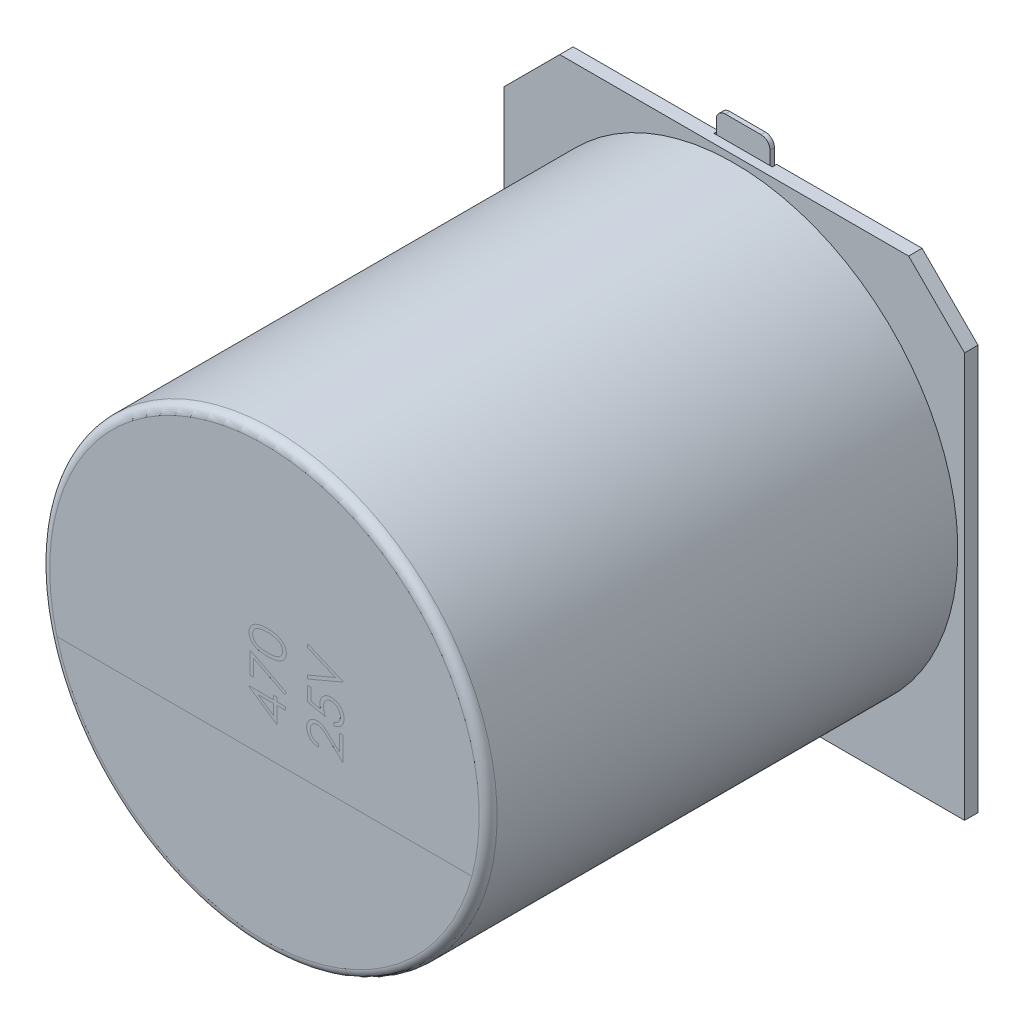
from build123d import *

# Parameters (mm, degrees)
RESSALTO_EXTRUS_O1_DEPTH   = 0.3
ESBO_O2_R                  = 5
RESSALTO_EXTRUS_O2_DEPTH   = 10.5
FILETE1_R                  = 0.2
CORTE_EXTRUS_O1_DEPTH      = 0.0001
CORTE_EXTRUS_O2_DEPTH      = 0.0001
ESBO_O5_W                  = 1.3
ESBO_O5_H                  = 3.2
CORTE_EXTRUS_O3_DEPTH      = 0.1
RESSALTO_EXTRUS_O3_DEPTH   = 0.1
RESSALTO_EXTRUS_O3_2_DEPTH = 0.1


with BuildPart() as part:
    # Esboço1 → Ressalto-extrusão1 (new body)
    with BuildSketch(Plane.XY):
        Polygon((-5.15, 3.9), (-3.9, 5.15), (3.9, 5.15), (5.15, 3.9), (5.15, -5.15), (-5.15, -5.15), align=None)
    extrude(amount=RESSALTO_EXTRUS_O1_DEPTH)

    # Esboço5 → Corte-extrusão3 (cut)
    with BuildSketch(Plane(origin=(0, 0, 0), x_dir=(-1, 0, 0), z_dir=(0, 0, -1))):
        with Locations((0, 4.05)):
            Rectangle(ESBO_O5_W, ESBO_O5_H)
        with Locations((0, -4.05)):
            Rectangle(ESBO_O5_W, ESBO_O5_H)
    extrude(amount=-CORTE_EXTRUS_O3_DEPTH, mode=Mode.SUBTRACT)


with BuildPart() as body_2:
    # Esboço2 → Ressalto-extrusão2 (new body)
    with BuildSketch(Plane.XY.offset(0.3)):
        with Locations(Location((0, 0, 0), (0, 0, 180))):
            Circle(ESBO_O2_R)
    extrude(amount=RESSALTO_EXTRUS_O2_DEPTH)

    # Filete1
    filete1_edges = [body_2.edges().sort_by_distance(p)[0] for p in [
        (5, 0, 10.8),
    ]]
    fillet(filete1_edges, radius=FILETE1_R)

    # Esboço3 → Corte-extrusão1 (cut)
    with BuildSketch(Plane.XY.offset(10.8)):
        with BuildLine():
            Line((-4.638191195, -1.235792231), (4.638191195, -1.235792231))
            ThreePointArc((4.638191195, -1.235792231), (0, -4.8), (-4.638191195, -1.235792231))
        make_face()
    extrude(amount=-CORTE_EXTRUS_O1_DEPTH, mode=Mode.SUBTRACT)

    # Esboço4 → Corte-extrusão2 (cut)
    # profile 1 of 6: a face of its own
    with BuildSketch(Plane.XY.offset(10.8)):
        Polygon((-0.345603573, -0.053115773), (-0.345603573, -0.038646372), (0.203915658, -0.038646372), (0.203915658, 0.052940167), (0.285325914, 0.052940167), (0.285325914, -0.038646372), (0.468498991, -0.038646372), (0.468498991, -0.109880346), (0.285325914, -0.109880346), (0.285325914, -0.486402782), align=None)
        Polygon((0.203915658, -0.109880346), (-0.140805897, -0.109880346), (0.203915658, -0.346478904), align=None, mode=Mode.SUBTRACT)
    # profile 2 of 6: a face of its own
    with BuildSketch(Plane.XY.offset(10.8)):
        Polygon((-0.325251009, 0.175055551), (-0.325251009, 0.66351709), (0.488851555, 0.246289526), (0.454983617, 0.18475482), (-0.243840752, 0.542991749), (-0.243840752, 0.175055551), align=None)
    # profile 3 of 6: a face of its own
    with BuildSketch(Plane.XY.offset(10.8)):
        with BuildLine():
            add(Edge.make_bspline(
                [(0.071942, 0.734751064), (0.059219914, 0.734825454), (0.034507078, 0.734969957), (-0.00150301, 0.73657751), (-0.035285076, 0.739247989), (-0.066840735, 0.742907715), (-0.096178136, 0.747361328), (-0.123218874, 0.753306628), (-0.148088112, 0.76006774), (-0.170866913, 0.76790376), (-0.191862285, 0.776745567), (-0.211462033, 0.786369287), (-0.229637975, 0.797155467), (-0.246674948, 0.808492502), (-0.262312749, 0.82082174), (-0.276731555, 0.833878818), (-0.28980977, 0.847924881), (-0.30155635, 0.862823694), (-0.311856387, 0.878474281), (-0.320984885, 0.894448969), (-0.328503981, 0.911033192), (-0.334654808, 0.928008628), (-0.339675871, 0.945411053), (-0.343124826, 0.963236025), (-0.345291044, 0.981524865), (-0.345498408, 0.993869064), (-0.345603573, 1.00012942)],
                knots=[0, 0, 0, 0, 1.646148282, 3.197666765, 4.66315463, 6.030252048, 7.307778049, 8.501004361, 9.610818041, 10.641065266, 11.615491391, 12.557119604, 13.464013759, 14.348536654, 15.203310953, 16.038349431, 16.863300206, 17.683791446, 18.490318933, 19.285717724, 20.06220424, 20.843281102, 21.620494212, 22.403315558, 23.190242141, 24, 24, 24, 24], degree=3))
            add(Edge.make_bspline(
                [(-0.345603573, 1.00012942), (-0.345515977, 1.00644517), (-0.345341692, 1.01901129), (-0.342888524, 1.037522708), (-0.339722149, 1.055711688), (-0.334643805, 1.073302268), (-0.328566908, 1.090627052), (-0.320548538, 1.107255208), (-0.311827939, 1.123773797), (-0.301189542, 1.139432401), (-0.289432362, 1.154698872), (-0.276084957, 1.169009594), (-0.261516717, 1.182730389), (-0.24540273, 1.195343026), (-0.227990069, 1.207388067), (-0.209132766, 1.218408268), (-0.188872613, 1.228632831), (-0.167303531, 1.238253949), (-0.143849378, 1.246667363), (-0.118656443, 1.254147561), (-0.091496591, 1.260278849), (-0.062521121, 1.265349316), (-0.031586489, 1.269284964), (0.001244629, 1.272149262), (0.035992772, 1.273662794), (0.059750363, 1.273947772), (0.071942, 1.274094013)],
                knots=[0, 0, 0, 0, 0.810910589, 1.61342667, 2.396193133, 3.181089899, 3.963115317, 4.752255436, 5.550715454, 6.36105385, 7.181178335, 8.024612154, 8.872680183, 9.750181803, 10.651284446, 11.591556747, 12.554036451, 13.566402641, 14.62422919, 15.753422176, 16.94128843, 18.199818041, 19.531985927, 20.947085226, 22.433341622, 24, 24, 24, 24], degree=3))
            add(Edge.make_bspline(
                [(0.071942, 1.274094013), (0.084080351, 1.273944554), (0.107784376, 1.273652688), (0.142377799, 1.272181723), (0.17503195, 1.269215002), (0.205781643, 1.265558146), (0.234641136, 1.260431007), (0.261591622, 1.254253228), (0.28672852, 1.247214567), (0.309871727, 1.23867203), (0.331403379, 1.229274851), (0.351514561, 1.21906126), (0.370366884, 1.208103247), (0.387825473, 1.196238854), (0.403874782, 1.183418752), (0.418492988, 1.169707575), (0.431925288, 1.155271903), (0.443811997, 1.139916431), (0.45453139, 1.124111976), (0.463568455, 1.107591709), (0.471398542, 1.090778428), (0.47780036, 1.073504269), (0.482765044, 1.055795901), (0.486177994, 1.037594454), (0.488577036, 1.019008678), (0.488759732, 1.006444296), (0.488851555, 1.00012942)],
                knots=[0, 0, 0, 0, 1.561645053, 3.049612875, 4.452756685, 5.778837748, 7.032101753, 8.221335837, 9.334924186, 10.387562255, 11.392109817, 12.355697819, 13.287721948, 14.19548756, 15.068665045, 15.927346723, 16.771751757, 17.602390507, 18.423119567, 19.225778204, 20.022010933, 20.807278863, 21.593079439, 22.384715467, 23.188155646, 24, 24, 24, 24], degree=3))
            add(Edge.make_bspline(
                [(0.488851555, 1.00012942), (0.488745793, 0.993869201), (0.488537249, 0.981525272), (0.486379671, 0.963234454), (0.482910869, 0.945481114), (0.47805389, 0.928177646), (0.472108737, 0.911235278), (0.464363177, 0.89488486), (0.455442746, 0.878944656), (0.445283883, 0.86345696), (0.433644479, 0.848713692), (0.420772596, 0.834628474), (0.406338155, 0.821568176), (0.390568411, 0.809345844), (0.373506091, 0.797888956), (0.355139743, 0.787195982), (0.335438006, 0.777370446), (0.314276706, 0.768377578), (0.291336231, 0.760404398), (0.266403599, 0.753388777), (0.239225568, 0.747785617), (0.209940125, 0.743036072), (0.178487766, 0.7392302), (0.144857112, 0.736578619), (0.109112023, 0.734971178), (0.084558104, 0.734825774), (0.071942, 0.734751064)],
                knots=[0, 0, 0, 0, 0.810927267, 1.598990287, 2.382942141, 3.152806972, 3.926217614, 4.706701772, 5.493896336, 6.292070767, 7.104102563, 7.925577746, 8.761822141, 9.623241997, 10.509042271, 11.423174113, 12.375371989, 13.360203808, 14.400680605, 15.520553799, 16.714061498, 17.994519714, 19.364400916, 20.818312473, 22.365209998, 24, 24, 24, 24], degree=3))
        make_face()
        with BuildLine():
            add(Edge.make_bspline(
                [(0.071623991, 0.805985039), (0.082225886, 0.806012722), (0.102802082, 0.806066449), (0.13264999, 0.80742941), (0.160535909, 0.809326513), (0.186448955, 0.811713177), (0.210298564, 0.815287547), (0.232183885, 0.819342888), (0.252064411, 0.824207022), (0.270113872, 0.829990544), (0.286587858, 0.836578538), (0.301925458, 0.843758841), (0.316308451, 0.85154088), (0.329701941, 0.860084171), (0.341942209, 0.86955762), (0.353339517, 0.879522037), (0.363497477, 0.890426314), (0.375682392, 0.905507742), (0.388273135, 0.925419045), (0.399237399, 0.950506088), (0.40612769, 0.976284493), (0.407003937, 0.993781291), (0.407441299, 1.002514486)],
                knots=[0, 0, 0, 0, 1.459098681, 2.831824031, 4.11146945, 5.306290378, 6.412266529, 7.42953815, 8.369053297, 9.227277979, 10.03601793, 10.809473603, 11.557037441, 12.285528272, 12.993193355, 13.685654407, 14.36688038, 15.041354379, 16.352855396, 17.594313975, 18.799247529, 20, 20, 20, 20], degree=3))
            add(Edge.make_bspline(
                [(0.407441299, 1.002514486), (0.407058336, 1.011298233), (0.40629377, 1.02883457), (0.399620933, 1.054589295), (0.388773019, 1.079385248), (0.376379534, 1.098953952), (0.364501248, 1.113800161), (0.354385544, 1.124441149), (0.343055639, 1.134206761), (0.330832223, 1.143469228), (0.317480736, 1.151964392), (0.303065666, 1.159689431), (0.287546902, 1.166738689), (0.276713408, 1.170754847), (0.271174522, 1.172808206)],
                knots=[0, 0, 0, 0, 1.353621445, 2.702441307, 4.075953605, 5.516772412, 6.261413105, 7.007624062, 7.778524365, 8.566925914, 9.372323995, 10.217594641, 11.088702136, 12, 12, 12, 12], degree=3))
            add(Edge.make_bspline(
                [(0.271174522, 1.172808206), (0.264092063, 1.175201196), (0.249711635, 1.180059992), (0.227404164, 1.186321948), (0.203999251, 1.191253494), (0.179636769, 1.195690186), (0.154137051, 1.198718468), (0.127578996, 1.201155919), (0.09994258, 1.202591628), (0.081165859, 1.202769599), (0.071623991, 1.202860039)],
                knots=[0, 0, 0, 0, 0.884706709, 1.796334032, 2.740027952, 3.714592787, 4.726048262, 5.777819803, 6.87074269, 8, 8, 8, 8], degree=3))
            add(Edge.make_bspline(
                [(0.071623991, 1.202860039), (0.062083667, 1.202735264), (0.043420753, 1.202491177), (0.016088951, 1.201558183), (-0.009870702, 1.199148908), (-0.034570041, 1.196473037), (-0.057872343, 1.192527596), (-0.079972678, 1.188273592), (-0.100597263, 1.182558323), (-0.120068967, 1.176453281), (-0.138166693, 1.169465998), (-0.154974374, 1.161774135), (-0.170574701, 1.153560465), (-0.184919474, 1.144635034), (-0.198091899, 1.135122162), (-0.209788879, 1.124680773), (-0.220579408, 1.113973972), (-0.232676388, 1.098746643), (-0.245108031, 1.078973493), (-0.256237175, 1.054199295), (-0.262823702, 1.028559068), (-0.263737107, 1.011189754), (-0.264193316, 1.002514486)],
                knots=[0, 0, 0, 0, 1.313483664, 2.569454835, 3.763100662, 4.901599063, 5.988328865, 7.015709358, 7.99797933, 8.932480776, 9.824041341, 10.666387587, 11.475829342, 12.24921787, 12.990555181, 13.709176526, 14.405678811, 15.080244297, 16.38186033, 17.610124501, 18.806354173, 20, 20, 20, 20], degree=3))
            add(Edge.make_bspline(
                [(-0.264193316, 1.002514486), (-0.263735972, 0.993734143), (-0.262820451, 0.976157462), (-0.256267635, 0.950243421), (-0.245140593, 0.925301858), (-0.232700339, 0.905463504), (-0.220625789, 0.890421162), (-0.210348957, 0.879746763), (-0.199223869, 0.869644153), (-0.186875016, 0.860416018), (-0.173528717, 0.851923386), (-0.159331722, 0.843840599), (-0.143965464, 0.836756316), (-0.127504396, 0.830147171), (-0.109453941, 0.824354003), (-0.089501481, 0.819545447), (-0.067563896, 0.815167825), (-0.043540029, 0.812015224), (-0.017621452, 0.80923915), (0.010335781, 0.807450237), (0.040286184, 0.806060205), (0.060968838, 0.806010596), (0.071623991, 0.805985039)],
                knots=[0, 0, 0, 0, 1.207546505, 2.417292871, 3.651582144, 4.952510111, 5.626719005, 6.30238548, 6.989136872, 7.692112372, 8.420316868, 9.164734959, 9.937886623, 10.746308695, 11.604196049, 12.543341915, 13.568754172, 14.680483261, 15.875568977, 17.154711427, 18.534182925, 20, 20, 20, 20], degree=3))
        make_face(mode=Mode.SUBTRACT)
    # profile 4 of 6: a face of its own
    with BuildSketch(Plane.XY.offset(10.8)):
        with BuildLine():
            Line((1.208686588, -0.384639961), (1.208686588, -0.455873936))
            add(Edge.make_bspline(
                [(1.208686588, -0.455873936), (1.199236226, -0.455409671), (1.180675967, -0.454497866), (1.153615009, -0.450227879), (1.12774901, -0.444118073), (1.103285655, -0.435479476), (1.080008639, -0.424751088), (1.058010422, -0.411885528), (1.03737492, -0.396646923), (1.018293432, -0.379364324), (1.000788394, -0.360593579), (0.985671937, -0.340340268), (0.972899894, -0.319057556), (0.962222541, -0.296810014), (0.954207968, -0.273346636), (0.948261275, -0.248880345), (0.944683425, -0.223303648), (0.944298845, -0.205877429), (0.944103255, -0.197014761)],
                knots=[0, 0, 0, 0, 1.10065271, 2.161652631, 3.183658789, 4.190468796, 5.17591951, 6.163126047, 7.15150782, 8.156236427, 9.156009102, 10.134482811, 11.092018607, 12.041330605, 13.001268258, 13.972401359, 14.968799086, 16, 16, 16, 16], degree=3))
            add(Edge.make_bspline(
                [(0.944103255, -0.197014761), (0.944305358, -0.18831055), (0.944702485, -0.171207085), (0.948164181, -0.146255257), (0.953468922, -0.122445229), (0.961329712, -0.10004684), (0.971193285, -0.078830219), (0.983459929, -0.059058064), (0.99754923, -0.040252262), (1.01416825, -0.02333577), (1.031900787, -0.007795932), (1.050838988, 0.005598469), (1.07042167, 0.017133833), (1.090801804, 0.026575168), (1.112045757, 0.03373212), (1.133949855, 0.039034735), (1.156766887, 0.042065996), (1.172212925, 0.042528662), (1.180065795, 0.042763885)],
                knots=[0, 0, 0, 0, 1.111674182, 2.184400057, 3.212814286, 4.223731311, 5.211378316, 6.196328225, 7.191884489, 8.207283132, 9.220262353, 10.201199469, 11.166417575, 12.120932471, 13.06540007, 14.026332106, 14.996573967, 16, 16, 16, 16], degree=3))
            add(Edge.make_bspline(
                [(1.180065795, 0.042763885), (1.191121103, 0.042379871), (1.213037713, 0.041618582), (1.245244725, 0.03510666), (1.276448681, 0.024935775), (1.301563175, 0.012691032), (1.321798141, 0.00033503), (1.338466838, -0.010788384), (1.35640982, -0.023884236), (1.375699712, -0.038840642), (1.396083895, -0.055915171), (1.417978262, -0.074664229), (1.440977972, -0.095572017), (1.456697317, -0.110233403), (1.464842688, -0.117830566)],
                knots=[0, 0, 0, 0, 1.184416499, 2.348048165, 3.509039915, 4.696071444, 5.333504901, 6.05069495, 6.844171097, 7.714965912, 8.667477798, 9.695072654, 10.805644396, 12, 12, 12, 12], degree=3))
            Line((1.464842688, -0.117830566), (1.676795562, -0.316427071))
            Line((1.676795562, -0.316427071), (1.676795562, 0.052940167))
            Line((1.676795562, 0.052940167), (1.758205819, 0.052940167))
            Line((1.758205819, 0.052940167), (1.758205819, -0.486402782))
            Line((1.758205819, -0.486402782), (1.429702714, -0.17857025))
            add(Edge.make_bspline(
                [(1.429702714, -0.17857025), (1.421878991, -0.171075461), (1.40685122, -0.156679506), (1.384911299, -0.1363181), (1.364557385, -0.11803033), (1.345827936, -0.101697814), (1.328448991, -0.087674858), (1.312983406, -0.07523062), (1.298751593, -0.065259852), (1.282255061, -0.054438682), (1.262113696, -0.043958011), (1.237499806, -0.034951816), (1.212161661, -0.029460234), (1.195038878, -0.028801459), (1.186425971, -0.02847009)],
                knots=[0, 0, 0, 0, 1.329631726, 2.553950428, 3.673215718, 4.687767853, 5.603093632, 6.413772471, 7.123043292, 7.734684054, 8.834405432, 9.900288307, 10.943827018, 12, 12, 12, 12], degree=3))
            add(Edge.make_bspline(
                [(1.186425971, -0.02847009), (1.181010011, -0.028614267), (1.170336194, -0.028898413), (1.154686674, -0.03140614), (1.139590725, -0.035195844), (1.125001913, -0.040626287), (1.111066917, -0.047794244), (1.097768774, -0.056519457), (1.084912527, -0.066586489), (1.072858118, -0.078232223), (1.061817916, -0.09102555), (1.052037989, -0.104540675), (1.043864834, -0.118839538), (1.037164791, -0.133861851), (1.031908945, -0.149565734), (1.028267089, -0.16598156), (1.025980526, -0.183063971), (1.025671151, -0.194728353), (1.025513511, -0.200671862)],
                knots=[0, 0, 0, 0, 0.991446411, 1.95395049, 2.89581595, 3.838931463, 4.798493298, 5.75982156, 6.748411868, 7.785213223, 8.824556874, 9.840280684, 10.836137867, 11.835679398, 12.848801643, 13.863922112, 14.911575587, 16, 16, 16, 16], degree=3))
            add(Edge.make_bspline(
                [(1.025513511, -0.200671862), (1.025669272, -0.206880734), (1.02597516, -0.219073933), (1.028292108, -0.23693825), (1.031804603, -0.254097705), (1.037383212, -0.270296265), (1.043974615, -0.285884699), (1.052348282, -0.300530217), (1.06207867, -0.314475982), (1.073361451, -0.327492612), (1.086038472, -0.339380937), (1.100009424, -0.349973264), (1.115173727, -0.359167402), (1.131469144, -0.367200405), (1.149057917, -0.373721028), (1.167873614, -0.378704439), (1.18783566, -0.382647468), (1.201620841, -0.383964766), (1.208686588, -0.384639961)],
                knots=[0, 0, 0, 0, 1.030878251, 2.024474673, 2.987898669, 3.934362936, 4.864849709, 5.795128259, 6.730474222, 7.685293701, 8.650606017, 9.611896181, 10.591709709, 11.591680886, 12.625074257, 13.701333388, 14.821793024, 16, 16, 16, 16], degree=3))
        make_face()
    # profile 5 of 6: a face of its own
    with BuildSketch(Plane.XY.offset(10.8)):
        with BuildLine():
            Line((0.964455819, 0.622811962), (1.045866075, 0.622811962))
            Line((1.045866075, 0.622811962), (1.045866075, 0.352822479))
            Line((1.045866075, 0.352822479), (1.254638862, 0.310050293))
            add(Edge.make_bspline(
                [(1.254638862, 0.310050293), (1.252318782, 0.318454036), (1.247823995, 0.334734959), (1.242833401, 0.358765142), (1.239824988, 0.381578016), (1.239414208, 0.396381538), (1.239215434, 0.403544884)],
                knots=[0, 0, 0, 0, 1.100273476, 2.13160584, 3.095893838, 4, 4, 4, 4], degree=3))
            add(Edge.make_bspline(
                [(1.239215434, 0.403544884), (1.239400945, 0.412410145), (1.239765704, 0.429841463), (1.243476183, 0.455305939), (1.248850508, 0.47973696), (1.257130674, 0.502773804), (1.267242233, 0.524780936), (1.279977962, 0.545380411), (1.294846895, 0.564861343), (1.311772453, 0.583089091), (1.33059354, 0.59954761), (1.350913659, 0.613849521), (1.372289391, 0.626332436), (1.395221738, 0.636067989), (1.419278191, 0.644013151), (1.44473644, 0.64925221), (1.471370474, 0.652751674), (1.489582615, 0.653141846), (1.498869631, 0.653340808)],
                knots=[0, 0, 0, 0, 1.052805225, 2.070078116, 3.052532748, 4.020689046, 4.973125432, 5.925915817, 6.89216474, 7.881560752, 8.877013184, 9.857446635, 10.830895175, 11.812622661, 12.812548702, 13.836681939, 14.896847428, 16, 16, 16, 16], degree=3))
            add(Edge.make_bspline(
                [(1.498869631, 0.653340808), (1.505338023, 0.653189842), (1.518187391, 0.652889952), (1.537270687, 0.651368264), (1.555947196, 0.648427218), (1.57418268, 0.644526477), (1.591994217, 0.639319181), (1.609481532, 0.633228301), (1.626453142, 0.625657741), (1.642984003, 0.617264929), (1.658884924, 0.607971472), (1.673774653, 0.597521185), (1.687992976, 0.586662736), (1.701117631, 0.574797875), (1.713199525, 0.5620615), (1.72429839, 0.548524478), (1.734613416, 0.53430959), (1.74372285, 0.519192954), (1.752105558, 0.503512475), (1.758982493, 0.48704142), (1.765130776, 0.470154801), (1.770031508, 0.452609551), (1.773871569, 0.434445419), (1.776479741, 0.415632461), (1.778379398, 0.396269345), (1.778498314, 0.383144119), (1.778558383, 0.376514135)],
                knots=[0, 0, 0, 0, 1.056393913, 2.098511576, 3.122979385, 4.141471433, 5.141222888, 6.151259816, 7.162667642, 8.172852865, 9.177685681, 10.166741883, 11.141342384, 12.097242845, 13.052202613, 14.005160326, 14.953864445, 15.917140761, 16.884916217, 17.854238259, 18.828761908, 19.81781811, 20.826036654, 21.857789401, 22.917898972, 24, 24, 24, 24], degree=3))
            add(Edge.make_bspline(
                [(1.778558383, 0.376514135), (1.778401289, 0.368605371), (1.778092226, 0.353045811), (1.774873683, 0.330246308), (1.770233505, 0.308323315), (1.763358828, 0.287370792), (1.754356929, 0.267476122), (1.743661311, 0.248354419), (1.730928342, 0.230242686), (1.716274485, 0.21326475), (1.700172983, 0.197658263), (1.682867024, 0.183506186), (1.664334566, 0.171063896), (1.644635871, 0.160286262), (1.623805881, 0.151104699), (1.601780413, 0.143888739), (1.578670772, 0.138065468), (1.562760982, 0.13560177), (1.554680178, 0.134350423)],
                knots=[0, 0, 0, 0, 1.046872515, 2.059598001, 3.044168548, 4.012104806, 4.973680974, 5.932408326, 6.910122221, 7.900780896, 8.89867654, 9.876692837, 10.858029398, 11.85084981, 12.847361615, 13.868568023, 14.917415949, 16, 16, 16, 16], degree=3))
            Line((1.554680178, 0.134350423), (1.554680178, 0.205584398))
            add(Edge.make_bspline(
                [(1.554680178, 0.205584398), (1.562250269, 0.207336028), (1.576800403, 0.210702757), (1.597230416, 0.218111867), (1.615442484, 0.227082822), (1.631547957, 0.237998912), (1.645841643, 0.250652057), (1.658444355, 0.265360684), (1.669828044, 0.281757082), (1.679333202, 0.299986657), (1.687340015, 0.3192562), (1.693053939, 0.339309296), (1.696512701, 0.359857341), (1.696935521, 0.373691864), (1.697148127, 0.38064825)],
                knots=[0, 0, 0, 0, 1.13623081, 2.183898708, 3.172478118, 4.09966615, 5.022692284, 5.957376522, 6.927682873, 7.937366477, 8.960015386, 9.976409503, 10.982481913, 12, 12, 12, 12], degree=3))
            add(Edge.make_bspline(
                [(1.697148127, 0.38064825), (1.696960428, 0.387441821), (1.696590849, 0.400818417), (1.693792198, 0.420514266), (1.689368736, 0.43947429), (1.68317172, 0.457732145), (1.67497343, 0.475198115), (1.664902304, 0.491847506), (1.653209606, 0.507917502), (1.63984528, 0.522985166), (1.62510942, 0.536781957), (1.609353374, 0.548973267), (1.592544618, 0.559127982), (1.574974844, 0.567685552), (1.556451306, 0.574183707), (1.537060863, 0.57881943), (1.516755608, 0.581541552), (1.502905961, 0.581916017), (1.495848547, 0.582106834)],
                knots=[0, 0, 0, 0, 1.027268864, 2.022700798, 3.002744649, 3.968653148, 4.933396556, 5.915045722, 6.907600446, 7.935526002, 8.956456544, 9.95700807, 10.942805781, 11.92166854, 12.907987664, 13.905483474, 14.932689774, 16, 16, 16, 16], degree=3))
            add(Edge.make_bspline(
                [(1.495848547, 0.582106834), (1.489480615, 0.581962037), (1.477068857, 0.581679814), (1.458846477, 0.579236628), (1.441577021, 0.575155324), (1.425185347, 0.569344376), (1.409723862, 0.562092128), (1.39522664, 0.55298671), (1.381557368, 0.542415839), (1.369067815, 0.530074587), (1.357522386, 0.51664986), (1.347715902, 0.501796841), (1.339376284, 0.485912052), (1.332543442, 0.468966056), (1.32710056, 0.450937978), (1.32333891, 0.431818109), (1.321087995, 0.411602091), (1.320782647, 0.397773686), (1.320625691, 0.390665527)],
                knots=[0, 0, 0, 0, 1.045723156, 2.038222538, 3.013889863, 3.95567481, 4.890389958, 5.81331128, 6.76251276, 7.723027653, 8.692928204, 9.666105983, 10.639751036, 11.635719707, 12.66315958, 13.728667616, 14.832476222, 16, 16, 16, 16], degree=3))
            add(Edge.make_bspline(
                [(1.320625691, 0.390665527), (1.32075736, 0.384513074), (1.321029225, 0.371809818), (1.323030949, 0.352323749), (1.326260217, 0.331846876), (1.330702098, 0.310457696), (1.33651486, 0.288091973), (1.34348047, 0.264796907), (1.351808495, 0.240523518), (1.358097765, 0.224168249), (1.361330819, 0.21576068)],
                knots=[0, 0, 0, 0, 0.817624296, 1.688186739, 2.600797293, 3.572016777, 4.590301741, 5.671205678, 6.80286297, 8, 8, 8, 8], degree=3))
            Line((1.361330819, 0.21576068), (0.964455819, 0.297170936))
            Line((0.964455819, 0.297170936), (0.964455819, 0.622811962))
        make_face()
    # profile 6 of 6: a face of its own
    with BuildSketch(Plane.XY.offset(10.8)):
        Polygon((0.964455819, 0.744927346), (0.964455819, 0.821249462), (1.589979156, 1.085832795), (0.964455819, 1.350416128), (0.964455819, 1.426738244), (1.758205819, 1.090920936), (1.758205819, 1.080744654), align=None)
    extrude(amount=-CORTE_EXTRUS_O2_DEPTH, mode=Mode.SUBTRACT)


with BuildPart() as body_3:
    # Esboço6 → Ressalto-extrusão3 (new body)
    with BuildSketch(Plane(origin=(0, 0, 0.1), x_dir=(-1, 0, 0), z_dir=(0, 0, -1))):
        with BuildLine():
            Line((-0.4, 5.65), (0.4, 5.65))
            ThreePointArc((0.4, 5.65), (0.541421356, 5.591421356), (0.6, 5.45))
            Line((0.6, 5.45), (0.6, 2.45))
            Line((0.6, 2.45), (-0.6, 2.45))
            Line((-0.6, 2.45), (-0.6, 5.45))
            ThreePointArc((-0.6, 5.45), (-0.541421356, 5.591421356), (-0.4, 5.65))
        make_face()
    extrude(amount=RESSALTO_EXTRUS_O3_DEPTH)


with BuildPart() as body_4:
    # Esboço6 → Ressalto-extrus_o3 2 (new body)
    with BuildSketch(Plane(origin=(0, 0, 0.1), x_dir=(-1, 0, 0), z_dir=(0, 0, -1))):
        with BuildLine():
            Line((-0.6, -2.45), (0.6, -2.45))
            Line((0.6, -2.45), (0.6, -5.45))
            ThreePointArc((0.6, -5.45), (0.541421356, -5.591421356), (0.4, -5.65))
            Line((0.4, -5.65), (-0.4, -5.65))
            ThreePointArc((-0.4, -5.65), (-0.541421356, -5.591421356), (-0.6, -5.45))
            Line((-0.6, -5.45), (-0.6, -2.45))
        make_face()
    extrude(amount=RESSALTO_EXTRUS_O3_2_DEPTH)


solid = Compound([part.part, body_2.part, body_3.part, body_4.part])
